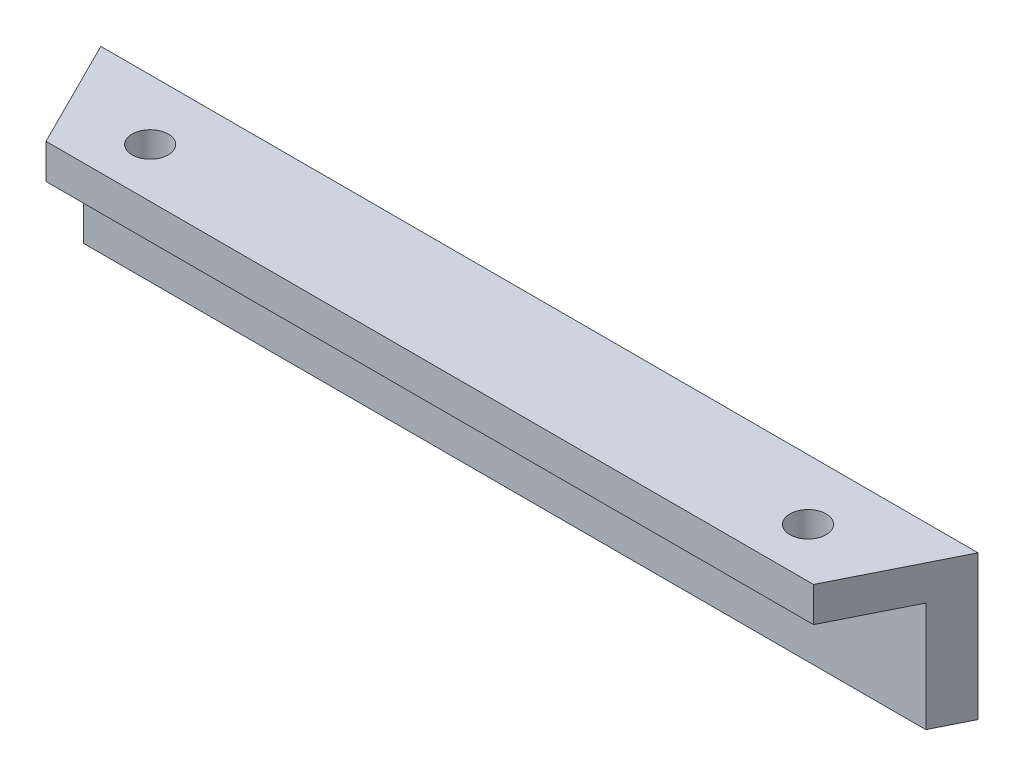
from build123d import *

# Parameters (mm, degrees)
SKETCH1_R           = 1.65
BOSS_EXTRUDE1_DEPTH = 3.175
BOSS_EXTRUDE2_DEPTH = 10


with BuildPart() as part:
    # Sketch1 → Boss-Extrude1 (new body)
    with BuildSketch(Plane(origin=(0, 0, 0), x_dir=(1, 0, 0), z_dir=(0, 1, 0))):
        Polygon((-21.997084548, 0), (58.002915452, 0), (53.002915452, -10), (-16.997084548, -10), align=None)
        with Locations(Location((-11.997084548, -5.5, 0), (0, 0, 270))):
            Circle(SKETCH1_R, mode=Mode.SUBTRACT)
        with Locations(Location((48.002915452, -5.5, 0), (0, 0, 90))):
            Circle(SKETCH1_R, mode=Mode.SUBTRACT)
    extrude(amount=BOSS_EXTRUDE1_DEPTH)

    # Sketch2 → Boss-Extrude2 (add)
    with BuildSketch(Plane.XZ):
        Polygon((58.002915452, 0), (56.415415452, 3.175), (-20.409584548, 3.175), (-21.997084548, 0), align=None)
    extrude(amount=BOSS_EXTRUDE2_DEPTH)


solid = part.part
